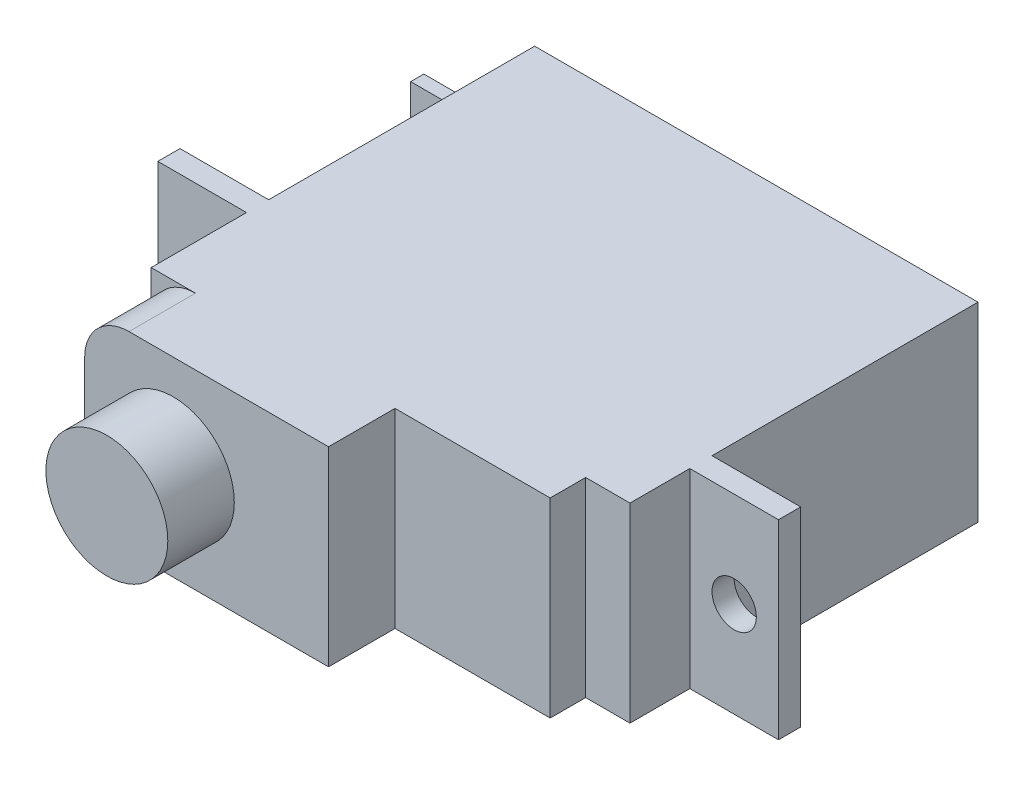
from build123d import *

# Parameters (mm, degrees)
SKETCH2_W           = 20
SKETCH2_H           = 8.6
BOSS_EXTRUDE1_DEPTH = 12
SKETCH3_W           = 28
SKETCH3_H           = 8.6
SKETCH3_R           = 1
BOSS_EXTRUDE2_DEPTH = 1
SKETCH4_W           = 20
SKETCH4_H           = 8.6
BOSS_EXTRUDE3_DEPTH = 2.7
SKETCH5_W           = 18
SKETCH5_H           = 8.6
BOSS_EXTRUDE4_DEPTH = 1.6
BOSS_EXTRUDE5_DEPTH = 3
SKETCH7_R           = 2.75
BOSS_EXTRUDE6_DEPTH = 3
SKETCH8_W           = 0.593912785
SKETCH8_H           = 2.2
BOSS_EXTRUDE7_DEPTH = 5


with BuildPart() as part:
    # Sketch2 → Boss-Extrude1 (new body)
    with BuildSketch(Plane.XY):
        Rectangle(SKETCH2_W, SKETCH2_H)
    extrude(amount=BOSS_EXTRUDE1_DEPTH)

    # Sketch3 → Boss-Extrude2 (add)
    with BuildSketch(Plane.XY.offset(12)):
        Rectangle(SKETCH3_W, SKETCH3_H)
        with Locations((12, 0)):
            Circle(SKETCH3_R, mode=Mode.SUBTRACT)
        with Locations((-12, 0)):
            Circle(SKETCH3_R, mode=Mode.SUBTRACT)
    extrude(amount=BOSS_EXTRUDE2_DEPTH)

    # Sketch4 → Boss-Extrude3 (add)
    with BuildSketch(Plane.XY.offset(13)):
        Rectangle(SKETCH4_W, SKETCH4_H)
    extrude(amount=BOSS_EXTRUDE3_DEPTH)

    # Sketch5 → Boss-Extrude4 (add)
    with BuildSketch(Plane.XY.offset(15.7)):
        with Locations((-1, 0)):
            Rectangle(SKETCH5_W, SKETCH5_H)
    extrude(amount=BOSS_EXTRUDE4_DEPTH)

    # Sketch6 → Boss-Extrude5 (add)
    with BuildSketch(Plane.XY.offset(17.3)):
        with BuildLine():
            Line((-8, 4.3), (1, 4.3))
            Line((1, 4.3), (1, -4.3))
            Line((1, -4.3), (-8, -4.3))
            ThreePointArc((-8, -4.3), (-9.414213562, -3.714213562), (-10, -2.3))
            Line((-10, -2.3), (-10, 2.3))
            ThreePointArc((-10, 2.3), (-9.414213562, 3.714213562), (-8, 4.3))
        make_face()
    extrude(amount=BOSS_EXTRUDE5_DEPTH)

    # Sketch7 → Boss-Extrude6 (add)
    with BuildSketch(Plane.XY.offset(20.3)):
        with Locations((-6, 0)):
            Circle(SKETCH7_R)
    extrude(amount=BOSS_EXTRUDE6_DEPTH)

    # Sketch8 → Boss-Extrude7 (add)
    with BuildSketch(Plane.ZY.offset(10)):
        with Locations((0.296956392, -0.387828177)):
            Rectangle(SKETCH8_W, SKETCH8_H)
    extrude(amount=BOSS_EXTRUDE7_DEPTH)


solid = part.part
